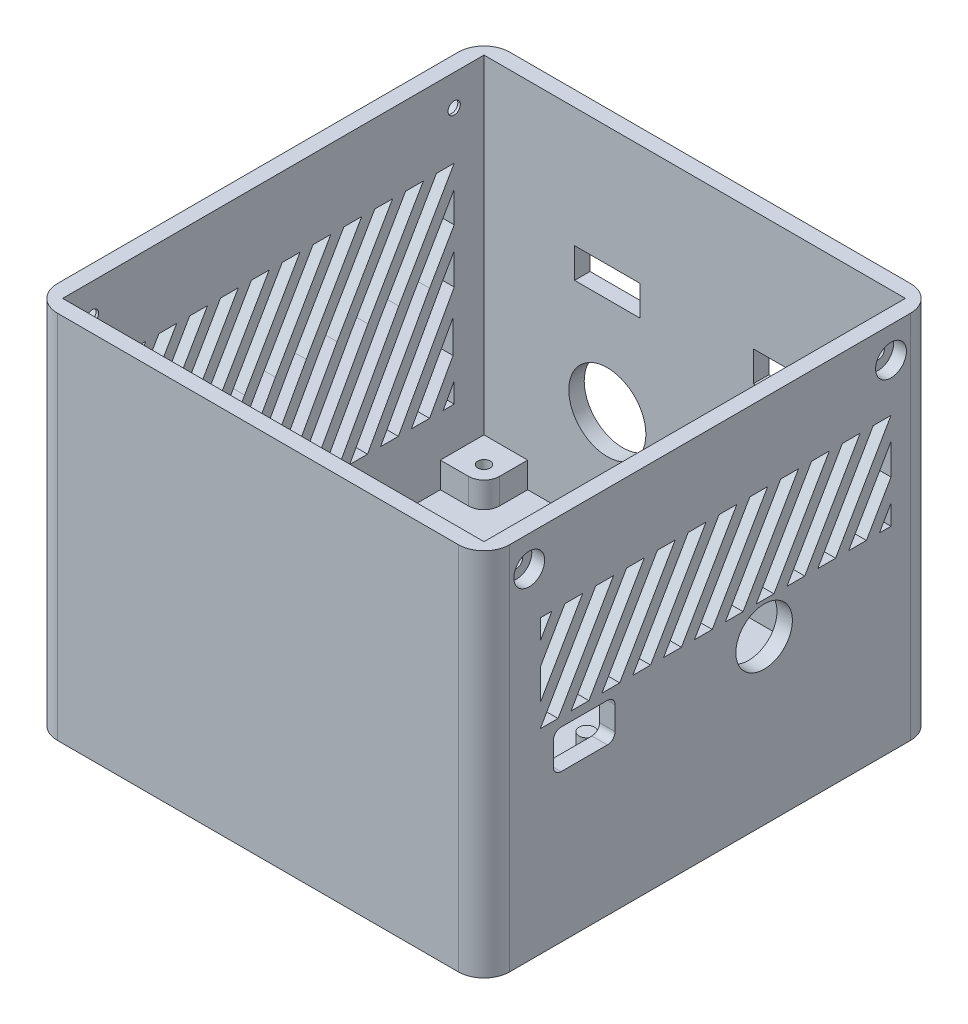
from build123d import *

# Parameters (mm, degrees)
SKETCH_1_W                = 88
SKETCH_1_H                = 88
EXTRUDE_1_DEPTH           = 3
SKETCH_2_W                = 88
SKETCH_2_H                = 88
SKETCH_2_W_2              = 82
SKETCH_2_H_2              = 82
EXTRUDE_2_DEPTH           = 69
SKETCH_3_R                = 1.5
SKETCH_3_W                = 8.5
SKETCH_3_H                = 8.5
EXTRUDE_3_DEPTH           = 5
SKETCH_4_R                = 1.2
CUT_EXTRUDE_1_DEPTH       = 6
FILLET_1_R                = 5
CUT_EXTRUDE_4_DEPTH       = 124.661536601
CUT_EXTRUDE_4_DEPTH_BACK  = 124.661536601
CUT_EXTRUDE_5_REACH       = 125.294
SKETCH_8_R                = 7.5
SKETCH_8_W                = 10.25
SKETCH_8_H                = 5.85
SKETCH_8_W_2              = 12.75
CUT_EXTRUDE_7_REACH       = 125.662
SKETCH_9_R                = 5.5
CUT_EXTRUDE_9_REACH       = 125.662
CUT_EXTRUDE_10_REACH      = 125.662
CUT_EXTRUDE_11_DEPTH      = 124.661536601
CUT_EXTRUDE_11_DEPTH_BACK = 124.661536601
SKETCH_13_R               = 1.2
SKETCH_14_R               = 3
CUT_EXTRUDE_12_DEPTH      = 2.5
CUT_EXTRUDE_START         = -2.5
SKETCH_15_R               = 3
CUT_EXTRUDE_13_DEPTH      = 2.5
FILLET_2_R                = 3


with BuildPart() as part:
    # 草圖1 → 填料-伸長1 (new body)
    with BuildSketch(Plane(origin=(0, 0, 0), x_dir=(1, 0, 0), z_dir=(0, 1, 0))):
        with Locations((3.681495416, 4.62278925)):
            Rectangle(SKETCH_1_W, SKETCH_1_H)
    extrude(amount=EXTRUDE_1_DEPTH)

    # 草圖2 → 填料-伸長2 (add)
    with BuildSketch(Plane(origin=(0, 3, 0), x_dir=(1, 0, 0), z_dir=(0, 1, 0))):
        with Locations((3.681495416, 4.62278925)):
            Rectangle(SKETCH_2_W, SKETCH_2_H)
        with Locations((3.681495416, 4.62278925)):
            Rectangle(SKETCH_2_W_2, SKETCH_2_H_2, mode=Mode.SUBTRACT)
    extrude(amount=EXTRUDE_2_DEPTH)

    # 草圖3 → 填料-伸長3 (add)
    with BuildSketch(Plane(origin=(0, 3, 0), x_dir=(1, 0, 0), z_dir=(0, 1, 0))):
        with Locations(Location((-17.318504584, 25.62278925, 0), (0, 0, 270))):
            Circle(SKETCH_3_R)
        with Locations(Location((2.681495416, 25.62278925, 0), (0, 0, 270))):
            Circle(SKETCH_3_R)
        with Locations(Location((22.681495416, 25.62278925, 0), (0, 0, 270))):
            Circle(SKETCH_3_R)
        with Locations(Location((22.681495416, 5.62278925, 0), (0, 0, 270))):
            Circle(SKETCH_3_R)
        with Locations(Location((2.681495416, -14.37721075, 0), (0, 0, 270))):
            Circle(SKETCH_3_R)
        with Locations(Location((22.681495416, -14.37721075, 0), (0, 0, 270))):
            Circle(SKETCH_3_R)
        with Locations(Location((-17.318504584, 5.62278925, 0), (0, 0, 270))):
            Circle(SKETCH_3_R)
        with Locations(Location((-17.318504584, -14.37721075, 0), (0, 0, 270))):
            Circle(SKETCH_3_R)
        with Locations(Location((2.681495416, 15.637587958, 0), (0, 0, 270))):
            Circle(SKETCH_3_R)
        with Locations((-33.068504584, -32.12721075)):
            Rectangle(SKETCH_3_W, SKETCH_3_H)
        with Locations((40.431495416, 41.37278925)):
            Rectangle(SKETCH_3_W, SKETCH_3_H)
        with Locations((40.431495416, -23.62721075)):
            Rectangle(SKETCH_3_W, SKETCH_3_H)
        with Locations((-33.068504584, 41.37278925)):
            Rectangle(SKETCH_3_W, SKETCH_3_H)
    extrude(amount=EXTRUDE_3_DEPTH)

    # 草圖4 → 除料-伸長1 (cut)
    with BuildSketch(Plane(origin=(0, 8, 0), x_dir=(1, 0, 0), z_dir=(0, 1, 0))):
        with Locations(Location((-32.318504584, -31.37721075, 0), (0, 0, 270))):
            Circle(SKETCH_4_R)
        with Locations(Location((39.681495416, 40.62278925, 0), (0, 0, 270))):
            Circle(SKETCH_4_R)
        with Locations(Location((39.681495416, -23.37721075, 0), (0, 0, 270))):
            Circle(SKETCH_4_R)
        with Locations(Location((-32.318504584, 40.62278925, 0), (0, 0, 270))):
            Circle(SKETCH_4_R)
    extrude(amount=-CUT_EXTRUDE_1_DEPTH, mode=Mode.SUBTRACT)

    # 圓角1
    fillet_1_edges = [part.edges().sort_by_distance(p)[0] for p in [
        (-40.318504584, 36, -48.62278925),
        (47.681495416, 36, -48.62278925),
        (47.681495416, 36, 39.37721075),
        (-40.318504584, 36, 39.37721075),
    ]]
    fillet(fillet_1_edges, radius=FILLET_1_R)

    # 草圖7 → 除料-伸長4 (cut, two sides: drawn at the far end of the back side and taken through both)
    with BuildSketch(Plane.ZY.offset(40.318504584).offset(-CUT_EXTRUDE_4_DEPTH_BACK)):
        Polygon((-39.82278925, 56.682587507), (-29.036392323, 38), (-25.572290708, 38), (-36.358687635, 56.682587507), align=None)
        Polygon((-33.82278925, 56.682587507), (-23.036392323, 38), (-19.572290708, 38), (-30.358687635, 56.682587507), align=None)
        Polygon((-27.82278925, 56.682587507), (-17.036392323, 38), (-13.572290708, 38), (-24.358687635, 56.682587507), align=None)
        Polygon((-21.82278925, 56.682587507), (-11.036392323, 38), (-7.572290708, 38), (-18.358687635, 56.682587507), align=None)
        Polygon((-15.82278925, 56.682587507), (-5.036392323, 38), (-1.572290708, 38), (-12.358687635, 56.682587507), align=None)
        Polygon((-9.82278925, 56.682587507), (0.963607677, 38), (4.427709292, 38), (-6.358687635, 56.682587507), align=None)
        Polygon((-3.82278925, 56.682587507), (6.963607677, 38), (10.427709292, 38), (-0.358687635, 56.682587507), align=None)
        Polygon((2.17721075, 56.682587507), (12.963607677, 38), (16.427709292, 38), (5.641312365, 56.682587507), align=None)
        Polygon((8.17721075, 56.682587507), (18.963607677, 38), (22.427709292, 38), (11.641312365, 56.682587507), align=None)
        Polygon((14.17721075, 56.682587507), (24.963607677, 38), (28.427709292, 38), (17.641312365, 56.682587507), align=None)
        Polygon((-35.036392323, 38), (-31.572290708, 38), (-39.82278925, 52.290282662), (-39.82278925, 46.290282662), align=None)
        Polygon((-39.82278925, 41.897977816), (-39.82278925, 38), (-37.572290708, 38), align=None)
        Polygon((28.427709292, 42.392304845), (28.427709292, 48.392304845), (23.641312365, 56.682587507), (20.17721075, 56.682587507), align=None)
        Polygon((28.427709292, 52.784609691), (28.427709292, 56.682587507), (26.17721075, 56.682587507), align=None)
    extrude(amount=CUT_EXTRUDE_4_DEPTH + CUT_EXTRUDE_4_DEPTH_BACK, mode=Mode.SUBTRACT)

    # 草圖8 → 除料-伸長5 (cut, up to next)
    with BuildSketch(Plane(origin=(0, 0, -48.62278925), x_dir=(-1, 0, 0), z_dir=(0, 0, -1)), mode=Mode.PRIVATE) as cut_extrude_5_sk1:
        with Locations((-20.241495416, 24)):
            Circle(SKETCH_8_R)
    cut_extrude_5_tool1 = extrude(cut_extrude_5_sk1.sketch, amount=-CUT_EXTRUDE_5_REACH, mode=Mode.PRIVATE) & part.part
    # 草圖8 → 除料-伸長5 (cut, up to next)
    with BuildSketch(Plane(origin=(0, 0, -48.62278925), x_dir=(-1, 0, 0), z_dir=(0, 0, -1)), mode=Mode.PRIVATE) as cut_extrude_5_sk2:
        with Locations((13.318504584, 23.82)):
            Circle(SKETCH_8_R)
    cut_extrude_5_tool2 = extrude(cut_extrude_5_sk2.sketch, amount=-CUT_EXTRUDE_5_REACH, mode=Mode.PRIVATE) & part.part
    # 草圖8 → 除料-伸長5 (cut, up to next)
    with BuildSketch(Plane(origin=(0, 0, -48.62278925), x_dir=(-1, 0, 0), z_dir=(0, 0, -1)), mode=Mode.PRIVATE) as cut_extrude_5_sk3:
        with Locations((-20.241495416, 45.775)):
            Rectangle(SKETCH_8_W, SKETCH_8_H)
    cut_extrude_5_tool3 = extrude(cut_extrude_5_sk3.sketch, amount=-CUT_EXTRUDE_5_REACH, mode=Mode.PRIVATE) & part.part
    # 草圖8 → 除料-伸長5 (cut, up to next)
    with BuildSketch(Plane(origin=(0, 0, -48.62278925), x_dir=(-1, 0, 0), z_dir=(0, 0, -1)), mode=Mode.PRIVATE) as cut_extrude_5_sk4:
        with Locations((13.313504584, 45.775)):
            Rectangle(SKETCH_8_W_2, SKETCH_8_H)
    cut_extrude_5_tool4 = extrude(cut_extrude_5_sk4.sketch, amount=-CUT_EXTRUDE_5_REACH, mode=Mode.PRIVATE) & part.part
    add(cut_extrude_5_tool1.solids().sort_by_distance((20.241495, 24, -48.622789))[0], mode=Mode.SUBTRACT)
    add(cut_extrude_5_tool2.solids().sort_by_distance((-13.318505, 23.82, -48.622789))[0], mode=Mode.SUBTRACT)
    add(cut_extrude_5_tool3.solids().sort_by_distance((20.241495, 45.775, -48.622789))[0], mode=Mode.SUBTRACT)
    add(cut_extrude_5_tool4.solids().sort_by_distance((-13.313505, 45.775, -48.622789))[0], mode=Mode.SUBTRACT)

    # 草圖9 → 除料-伸長7 (cut, up to next)
    with BuildSketch(Plane(origin=(47.681495416, 0, 0), x_dir=(0, 0, -1), z_dir=(1, 0, 0)), mode=Mode.PRIVATE) as cut_extrude_7_sk1:
        with Locations((15.13278925, 31.75)):
            Circle(SKETCH_9_R)
    cut_extrude_7_tool1 = extrude(cut_extrude_7_sk1.sketch, amount=-CUT_EXTRUDE_7_REACH, mode=Mode.PRIVATE) & part.part
    add(cut_extrude_7_tool1.solids().sort_by_distance((47.681495, 31.75, -15.132789))[0], mode=Mode.SUBTRACT)

    # 草圖11 → 除料-伸長9 (cut, up to next)
    with BuildSketch(Plane(origin=(47.681495416, 0, 0), x_dir=(0, 0, -1), z_dir=(1, 0, 0)), mode=Mode.PRIVATE) as cut_extrude_9_sk1:
        with BuildLine():
            Line((-24.37721075, 36.25), (-15.37721075, 36.25))
            ThreePointArc((-15.37721075, 36.25), (-14.316550578, 35.810660172), (-13.87721075, 34.75))
            Line((-13.87721075, 34.75), (-13.87721075, 30.25))
            ThreePointArc((-13.87721075, 30.25), (-14.316550578, 29.189339828), (-15.37721075, 28.75))
            Line((-15.37721075, 28.75), (-24.37721075, 28.75))
            ThreePointArc((-24.37721075, 28.75), (-25.437870922, 29.189339828), (-25.87721075, 30.25))
            Line((-25.87721075, 30.25), (-25.87721075, 34.75))
            ThreePointArc((-25.87721075, 34.75), (-25.437870922, 35.810660172), (-24.37721075, 36.25))
        make_face()
    cut_extrude_9_tool1 = extrude(cut_extrude_9_sk1.sketch, amount=-CUT_EXTRUDE_9_REACH, mode=Mode.PRIVATE) & part.part
    add(cut_extrude_9_tool1.solids().sort_by_distance((47.681495, 32.5, 19.877211))[0], mode=Mode.SUBTRACT)

    # 草圖12 → 除料-伸長10 (cut, up to next)
    with BuildSketch(Plane.ZY.offset(40.318504584), mode=Mode.PRIVATE) as cut_extrude_10_sk1:
        Polygon((-35.036392323, 38), (-22.960906913, 16.078481792), (-19.496805298, 16.078481792), (-31.572290708, 38), align=None)
    cut_extrude_10_tool1 = extrude(cut_extrude_10_sk1.sketch, amount=-CUT_EXTRUDE_10_REACH, mode=Mode.PRIVATE) & part.part
    # 草圖12 → 除料-伸長10 (cut, up to next)
    with BuildSketch(Plane.ZY.offset(40.318504584), mode=Mode.PRIVATE) as cut_extrude_10_sk2:
        Polygon((-13.496805298, 16.078481792), (-16.960906913, 16.078481792), (-29.036392323, 38), (-25.572290708, 38), align=None)
    cut_extrude_10_tool2 = extrude(cut_extrude_10_sk2.sketch, amount=-CUT_EXTRUDE_10_REACH, mode=Mode.PRIVATE) & part.part
    # 草圖12 → 除料-伸長10 (cut, up to next)
    with BuildSketch(Plane.ZY.offset(40.318504584), mode=Mode.PRIVATE) as cut_extrude_10_sk3:
        Polygon((-7.496805298, 16.078481792), (-10.960906913, 16.078481792), (-23.036392323, 38), (-19.572290708, 38), align=None)
    cut_extrude_10_tool3 = extrude(cut_extrude_10_sk3.sketch, amount=-CUT_EXTRUDE_10_REACH, mode=Mode.PRIVATE) & part.part
    # 草圖12 → 除料-伸長10 (cut, up to next)
    with BuildSketch(Plane.ZY.offset(40.318504584), mode=Mode.PRIVATE) as cut_extrude_10_sk4:
        Polygon((-1.496805298, 16.078481792), (-4.960906913, 16.078481792), (-17.036392323, 38), (-13.572290708, 38), align=None)
    cut_extrude_10_tool4 = extrude(cut_extrude_10_sk4.sketch, amount=-CUT_EXTRUDE_10_REACH, mode=Mode.PRIVATE) & part.part
    # 草圖12 → 除料-伸長10 (cut, up to next)
    with BuildSketch(Plane.ZY.offset(40.318504584), mode=Mode.PRIVATE) as cut_extrude_10_sk5:
        Polygon((4.503194702, 16.078481792), (1.039093087, 16.078481792), (-11.036392323, 38), (-7.572290708, 38), align=None)
    cut_extrude_10_tool5 = extrude(cut_extrude_10_sk5.sketch, amount=-CUT_EXTRUDE_10_REACH, mode=Mode.PRIVATE) & part.part
    # 草圖12 → 除料-伸長10 (cut, up to next)
    with BuildSketch(Plane.ZY.offset(40.318504584), mode=Mode.PRIVATE) as cut_extrude_10_sk6:
        Polygon((10.503194702, 16.078481792), (7.039093087, 16.078481792), (-5.036392323, 38), (-1.572290708, 38), align=None)
    cut_extrude_10_tool6 = extrude(cut_extrude_10_sk6.sketch, amount=-CUT_EXTRUDE_10_REACH, mode=Mode.PRIVATE) & part.part
    # 草圖12 → 除料-伸長10 (cut, up to next)
    with BuildSketch(Plane.ZY.offset(40.318504584), mode=Mode.PRIVATE) as cut_extrude_10_sk7:
        Polygon((16.503194702, 16.078481792), (13.039093087, 16.078481792), (0.963607677, 38), (4.427709292, 38), align=None)
    cut_extrude_10_tool7 = extrude(cut_extrude_10_sk7.sketch, amount=-CUT_EXTRUDE_10_REACH, mode=Mode.PRIVATE) & part.part
    # 草圖12 → 除料-伸長10 (cut, up to next)
    with BuildSketch(Plane.ZY.offset(40.318504584), mode=Mode.PRIVATE) as cut_extrude_10_sk8:
        Polygon((22.503194702, 16.078481792), (19.039093087, 16.078481792), (6.963607677, 38), (10.427709292, 38), align=None)
    cut_extrude_10_tool8 = extrude(cut_extrude_10_sk8.sketch, amount=-CUT_EXTRUDE_10_REACH, mode=Mode.PRIVATE) & part.part
    # 草圖12 → 除料-伸長10 (cut, up to next)
    with BuildSketch(Plane.ZY.offset(40.318504584), mode=Mode.PRIVATE) as cut_extrude_10_sk9:
        Polygon((-37.572290708, 38), (-25.496805298, 16.078481792), (-28.956805298, 16.078481792), (-39.82278925, 35.804302904), (-39.82278925, 38), align=None)
    cut_extrude_10_tool9 = extrude(cut_extrude_10_sk9.sketch, amount=-CUT_EXTRUDE_10_REACH, mode=Mode.PRIVATE) & part.part
    # 草圖12 → 除料-伸長10 (cut, up to next)
    with BuildSketch(Plane.ZY.offset(40.318504584), mode=Mode.PRIVATE) as cut_extrude_10_sk10:
        Polygon((-31.496805298, 16.078481792), (-35.030782016, 16.078481792), (-39.599726876, 24.37282397), (-39.599726876, 30.788312236), align=None)
    cut_extrude_10_tool10 = extrude(cut_extrude_10_sk10.sketch, amount=-CUT_EXTRUDE_10_REACH, mode=Mode.PRIVATE) & part.part
    # 草圖12 → 除料-伸長10 (cut, up to next)
    with BuildSketch(Plane.ZY.offset(40.318504584), mode=Mode.PRIVATE) as cut_extrude_10_sk11:
        Polygon((-39.82278925, 16.078481792), (-39.82278925, 19.978481792), (-37.674471207, 16.078481792), align=None)
    cut_extrude_10_tool11 = extrude(cut_extrude_10_sk11.sketch, amount=-CUT_EXTRUDE_10_REACH, mode=Mode.PRIVATE) & part.part
    # 草圖12 → 除料-伸長10 (cut, up to next)
    with BuildSketch(Plane.ZY.offset(40.318504584), mode=Mode.PRIVATE) as cut_extrude_10_sk12:
        Polygon((12.963607677, 38), (24.965116369, 16.212777177), (28.429217984, 16.212777177), (16.427709292, 38), align=None)
    cut_extrude_10_tool12 = extrude(cut_extrude_10_sk12.sketch, amount=-CUT_EXTRUDE_10_REACH, mode=Mode.PRIVATE) & part.part
    # 草圖12 → 除料-伸長10 (cut, up to next)
    with BuildSketch(Plane.ZY.offset(40.318504584), mode=Mode.PRIVATE) as cut_extrude_10_sk13:
        Polygon((18.963607677, 38), (28.518268502, 20.654720358), (28.518268502, 26.943359204), (22.427709292, 38), align=None)
    cut_extrude_10_tool13 = extrude(cut_extrude_10_sk13.sketch, amount=-CUT_EXTRUDE_10_REACH, mode=Mode.PRIVATE) & part.part
    # 草圖12 → 除料-伸長10 (cut, up to next)
    with BuildSketch(Plane.ZY.offset(40.318504584), mode=Mode.PRIVATE) as cut_extrude_10_sk14:
        Polygon((24.963607677, 38), (28.728964288, 31.164470767), (28.427709292, 38), align=None)
    cut_extrude_10_tool14 = extrude(cut_extrude_10_sk14.sketch, amount=-CUT_EXTRUDE_10_REACH, mode=Mode.PRIVATE) & part.part
    add(cut_extrude_10_tool1.solids().sort_by_distance((-40.318505, 27.039241, -27.266599))[0], mode=Mode.SUBTRACT)
    add(cut_extrude_10_tool2.solids().sort_by_distance((-40.318505, 27.039241, -21.266599))[0], mode=Mode.SUBTRACT)
    add(cut_extrude_10_tool3.solids().sort_by_distance((-40.318505, 27.039241, -15.266599))[0], mode=Mode.SUBTRACT)
    add(cut_extrude_10_tool4.solids().sort_by_distance((-40.318505, 27.039241, -9.266599))[0], mode=Mode.SUBTRACT)
    add(cut_extrude_10_tool5.solids().sort_by_distance((-40.318505, 27.039241, -3.266599))[0], mode=Mode.SUBTRACT)
    add(cut_extrude_10_tool6.solids().sort_by_distance((-40.318505, 27.039241, 2.733401))[0], mode=Mode.SUBTRACT)
    add(cut_extrude_10_tool7.solids().sort_by_distance((-40.318505, 27.039241, 8.733401))[0], mode=Mode.SUBTRACT)
    add(cut_extrude_10_tool8.solids().sort_by_distance((-40.318505, 27.039241, 14.733401))[0], mode=Mode.SUBTRACT)
    add(cut_extrude_10_tool9.solids().sort_by_distance((-40.318505, 26.856977, -33.140506))[0], mode=Mode.SUBTRACT)
    add(cut_extrude_10_tool10.solids().sort_by_distance((-40.318505, 21.978623, -36.34963))[0], mode=Mode.SUBTRACT)
    add(cut_extrude_10_tool11.solids().sort_by_distance((-40.318505, 17.378482, -39.106683))[0], mode=Mode.SUBTRACT)
    add(cut_extrude_10_tool12.solids().sort_by_distance((-40.318505, 27.106389, 20.696413))[0], mode=Mode.SUBTRACT)
    add(cut_extrude_10_tool13.solids().sort_by_distance((-40.318505, 30.783486, 24.543046))[0], mode=Mode.SUBTRACT)
    add(cut_extrude_10_tool14.solids().sort_by_distance((-40.318505, 35.72149, 27.373427))[0], mode=Mode.SUBTRACT)

    # 草圖13 → 除料-伸長11 (cut, two sides: drawn at the far end of the back side and taken through both)
    with BuildSketch(Plane.ZY.offset(40.318504584).offset(-CUT_EXTRUDE_11_DEPTH_BACK)):
        with Locations((-39.82278925, 66)):
            Circle(SKETCH_13_R)
        with Locations((30.57721075, 66)):
            Circle(SKETCH_13_R)
    extrude(amount=CUT_EXTRUDE_11_DEPTH + CUT_EXTRUDE_11_DEPTH_BACK, mode=Mode.SUBTRACT)

    # 草圖14 → 除料-伸長12 (cut)
    with BuildSketch(Plane.ZY.offset(40.318504584)):
        with Locations((-39.82278925, 66)):
            Circle(SKETCH_14_R)
        with Locations((30.57721075, 66)):
            Circle(SKETCH_14_R)
    extrude(amount=-CUT_EXTRUDE_12_DEPTH, mode=Mode.SUBTRACT)

    # 草圖15 → 除料-伸長13 (cut)
    with BuildSketch(Plane(origin=(47.681495416, 0, 0), x_dir=(0, 0, -1), z_dir=(1, 0, 0)).offset(CUT_EXTRUDE_START)):
        with Locations(Location((-30.57721075, 66, 0), (0, 0, 180))):
            Circle(SKETCH_15_R)
        with Locations(Location((39.82278925, 66, 0), (0, 0, 180))):
            Circle(SKETCH_15_R)
    extrude(amount=CUT_EXTRUDE_13_DEPTH, mode=Mode.SUBTRACT)

    # 圓角2
    fillet_2_edges = [part.edges().sort_by_distance(p)[0] for p in [
        (-28.818504584, 5.5, -37.12278925),
        (-28.818504584, 5.5, 27.87721075),
        (36.181495416, 5.5, -37.12278925),
        (36.181495416, 5.5, 19.37721075),
        (36.181495416, 5.5, 27.87721075),
    ]]
    fillet(fillet_2_edges, radius=FILLET_2_R)


solid = part.part
